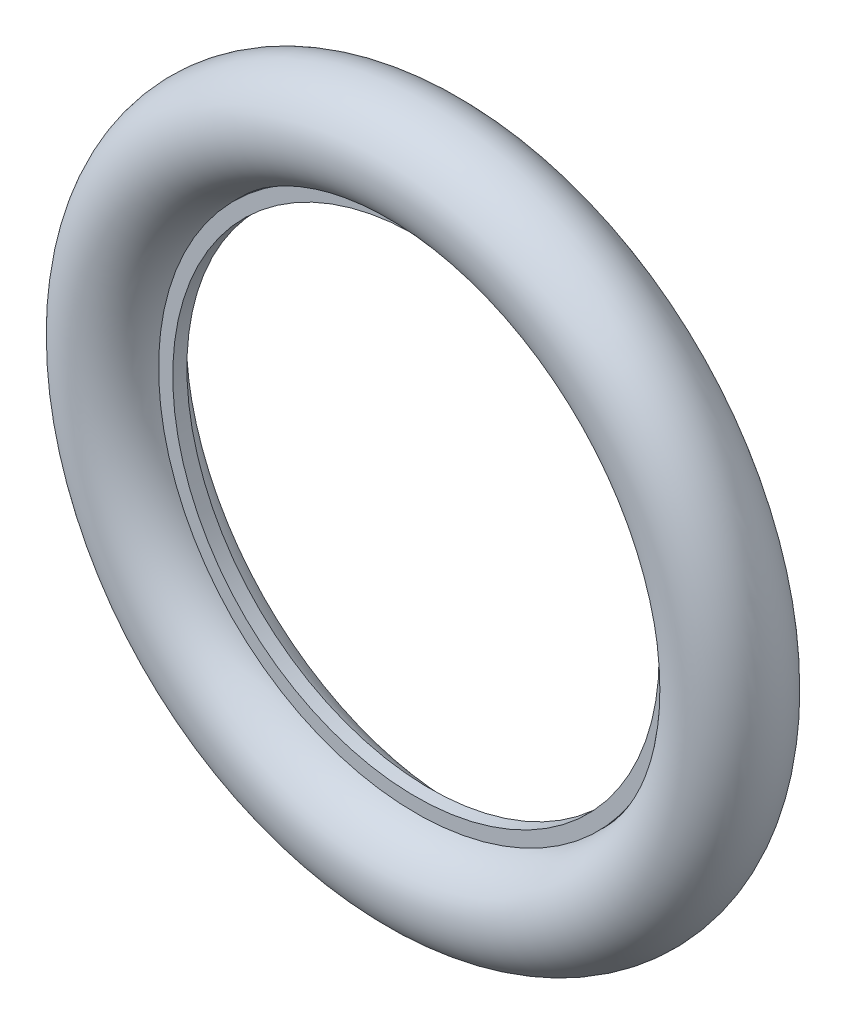
from build123d import *

# Parameters (mm, degrees)
SKETCH1_R           = 0.889
SKETCH3_R           = 4.6228
SKETCH3_R_2         = 4.3688
BOSS_EXTRUDE1_DEPTH = 0.127


with BuildPart() as part:
    # Sketch1 → Revolve1 (revolve)
    with BuildSketch(Plane(origin=(0, 0, 0), x_dir=(0, -1, 0), z_dir=(1, 0, 0)), mode=Mode.PRIVATE) as revolve1_sk:
        with Locations((5.5118, 0)):
            Circle(SKETCH1_R)
    revolve(revolve1_sk.sketch.rotate(Axis((0, 0, 0.889), (0, 0, -1)), 270), axis=Axis((0, 0, 0.889), (0, 0, -1)))


with BuildPart() as body_2:
    # Sketch3 → Boss-Extrude1 (new, symmetric)
    with BuildSketch(Plane.XY):
        Circle(SKETCH3_R)
        Circle(SKETCH3_R_2, mode=Mode.SUBTRACT)
    extrude(amount=BOSS_EXTRUDE1_DEPTH, both=True)


solid = Compound([part.part, body_2.part])
